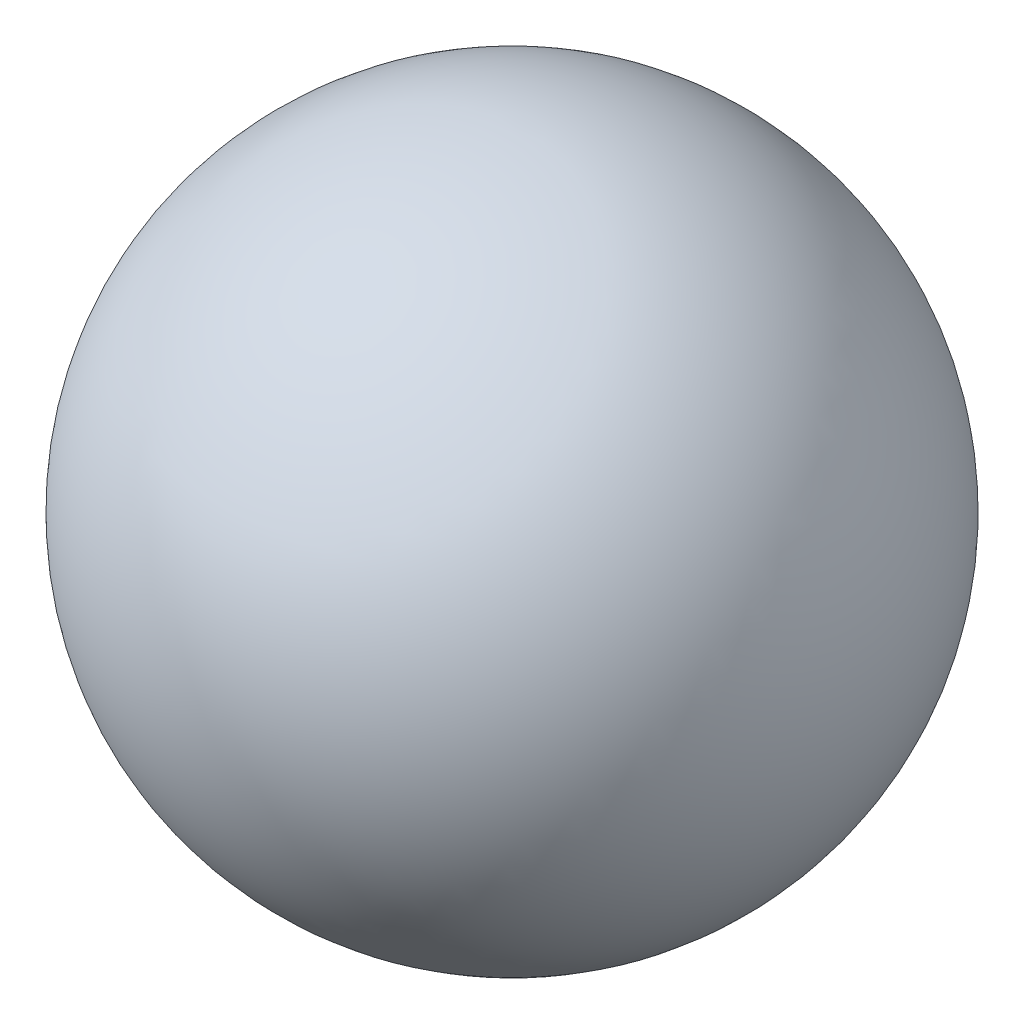
from build123d import *

# Parameters (mm, degrees)
KES_EKSTR_ZYON1_DEPTH      = 35.641016151
KES_EKSTR_ZYON1_DEPTH_BACK = 35.641016151
M10_DI_LI_DELIK1_D         = 8.5
M10_DI_LI_DELIK1_DEPTH     = 10
M10_DI_LI_DELIK1_TIP       = 2.553657631


with BuildPart() as part:
    # Çizim1 → Döndür1 (revolve)
    with BuildSketch(Plane.XY):
        with BuildLine():
            Line((0, 20), (0, -20))
            ThreePointArc((0, -20), (20, 0), (0, 20))
        make_face()
    revolve(axis=Axis((0, 20, 0), (0, -1, 0)))

    # Çizim2 → Kes-Ekstrüzyon1 (cut, two sides: drawn at the far end of the back side and taken through both)
    with BuildSketch(Plane.XY.offset(-KES_EKSTR_ZYON1_DEPTH_BACK)):
        Polygon((-113.979792733, -18), (-8.717797887, -18), (8.717797887, -18), (113.979792733, -18), (113.979792733, -228.523989691), (-113.979792733, -228.523989691), align=None)
    extrude(amount=KES_EKSTR_ZYON1_DEPTH + KES_EKSTR_ZYON1_DEPTH_BACK, mode=Mode.SUBTRACT)

    # M10 Dişli Delik1
    with Locations(Plane(origin=(0, -18, 0), x_dir=(-1, 0, 0), z_dir=(0, -1, 0))):
        with Locations((0, 0)):
            Hole(M10_DI_LI_DELIK1_D / 2, depth=M10_DI_LI_DELIK1_DEPTH)
            with Locations((0, 0, -(M10_DI_LI_DELIK1_DEPTH + M10_DI_LI_DELIK1_TIP / 2))):  # 118° drill point
                Cone(0, M10_DI_LI_DELIK1_D / 2, M10_DI_LI_DELIK1_TIP, mode=Mode.SUBTRACT)


solid = part.part
